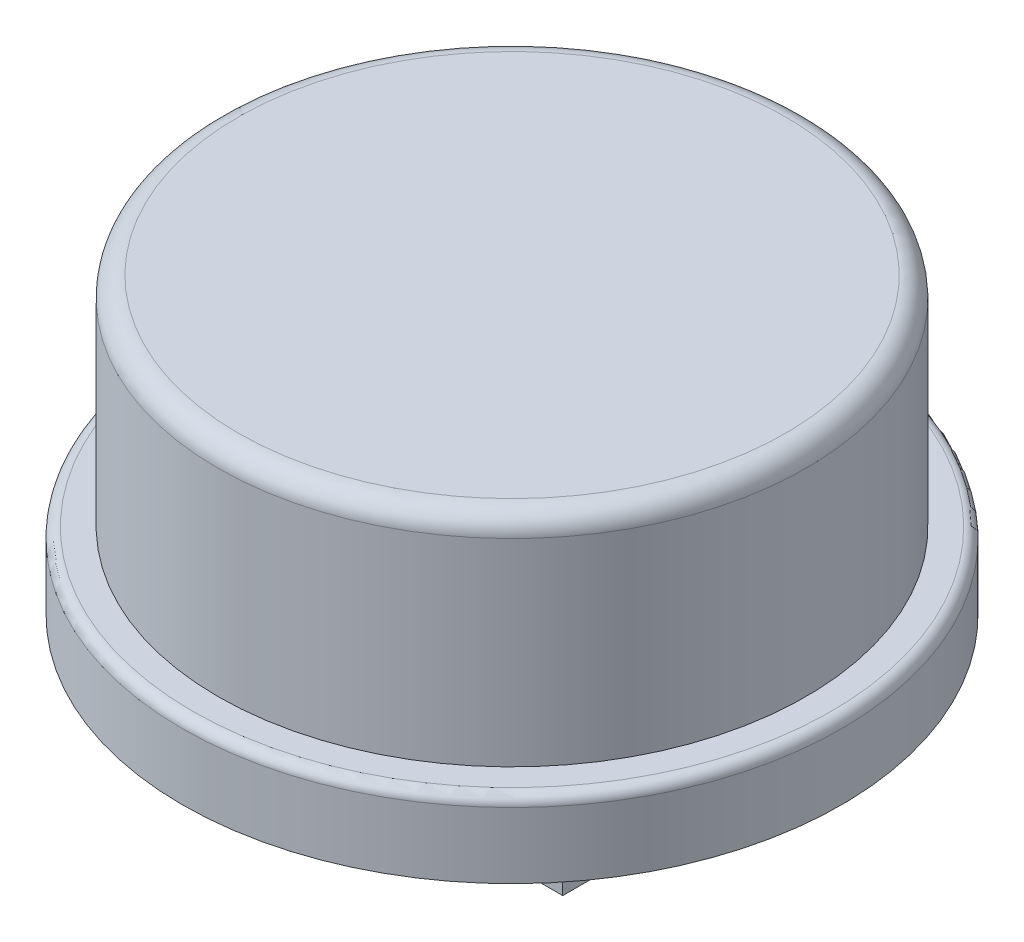
from build123d import *

# Parameters (mm, degrees)
SKETCH1_R           = 6.5
BOSS_EXTRUDE1_DEPTH = 1.5
SKETCH2_R           = 5.8
BOSS_EXTRUDE2_DEPTH = 4.3
FILLET1_R           = 0.4
SKETCH3_R           = 5
CUT_EXTRUDE1_DEPTH  = 4.8
BOSS_EXTRUDE3_START = 4.8
BOSS_EXTRUDE3_DEPTH = 4.8
SKETCH5_W           = 2
SKETCH5_H           = 0.8
SKETCH5_W_2         = 1
SKETCH5_H_2         = 3.8
BOSS_EXTRUDE4_DEPTH = 7.2
CUT_EXTRUDE2_REACH  = 14.102
BOSS_EXTRUDE5_DEPTH = 3.8
FILLET2_R           = 0.1
FILLET3_R           = 0.2


with BuildPart() as part:
    # Sketch1 → Boss-Extrude1 (new body)
    with BuildSketch(Plane(origin=(0, 0, 0), x_dir=(1, 0, 0), z_dir=(0, 1, 0))):
        with Locations(Location((0, 0, 0), (0, 0, 270))):
            Circle(SKETCH1_R)
    extrude(amount=BOSS_EXTRUDE1_DEPTH)

    # Sketch2 → Boss-Extrude2 (add)
    with BuildSketch(Plane(origin=(0, 1.5, 0), x_dir=(1, 0, 0), z_dir=(0, 1, 0))):
        with Locations(Location((0, 0, 0), (0, 0, 90))):
            Circle(SKETCH2_R)
    extrude(amount=BOSS_EXTRUDE2_DEPTH)

    # Fillet1
    fillet1_edges = [part.edges().sort_by_distance(p)[0] for p in [
        (0, 5.8, 5.8),
    ]]
    fillet(fillet1_edges, radius=FILLET1_R)

    # Sketch3 → Cut-Extrude1 (cut)
    with BuildSketch(Plane.XZ):
        with Locations(Location((0, 0, 0), (0, 0, 270))):
            Circle(SKETCH3_R)
    extrude(amount=-CUT_EXTRUDE1_DEPTH, mode=Mode.SUBTRACT)

    # Sketch4 → Boss-Extrude3 (add)
    with BuildSketch(Plane.XZ.offset(-4.8).offset(BOSS_EXTRUDE3_START)):
        with BuildLine():
            Line((-4.990991885, 0.3), (-2.9, 0.3))
            Line((-2.9, 0.3), (-2.9, -0.3))
            Line((-2.9, -0.3), (-4.990991885, -0.3))
            ThreePointArc((-4.990991885, -0.3), (-5, 0), (-4.990991885, 0.3))
        make_face()
        with BuildLine():
            Line((2.9, 0.3), (2.9, -0.3))
            Line((2.9, -0.3), (4.990991885, -0.3))
            ThreePointArc((4.990991885, -0.3), (5, 0), (4.990991885, 0.3))
            Line((4.990991885, 0.3), (2.9, 0.3))
        make_face()
        with BuildLine():
            Line((-0.3, 4.990991885), (-0.3, 2.7))
            Line((-0.3, 2.7), (0.3, 2.7))
            Line((0.3, 2.7), (0.3, 4.990991885))
            ThreePointArc((0.3, 4.990991885), (0, 5), (-0.3, 4.990991885))
        make_face()
        with BuildLine():
            Line((0.3, -2.7), (-0.3, -2.7))
            Line((-0.3, -2.7), (-0.3, -4.990991885))
            ThreePointArc((-0.3, -4.990991885), (0, -5), (0.3, -4.990991885))
            Line((0.3, -4.990991885), (0.3, -2.7))
        make_face()
    extrude(amount=-BOSS_EXTRUDE3_DEPTH)

    # Sketch5 → Boss-Extrude4 (add)
    with BuildSketch(Plane.XZ.offset(-4.8)):
        with Locations((0, 2.3)):
            Rectangle(SKETCH5_W, SKETCH5_H)
        with Locations((-2.4, 0)):
            Rectangle(SKETCH5_W_2, SKETCH5_H_2)
        with Locations((2.4, 0)):
            Rectangle(SKETCH5_W_2, SKETCH5_H_2)
        with Locations((0, -2.3)):
            Rectangle(SKETCH5_W, SKETCH5_H)
    extrude(amount=BOSS_EXTRUDE4_DEPTH)

    # Sketch6 → Cut-Extrude2 (cut, up to next)
    with BuildSketch(Plane.XY.offset(1.9), mode=Mode.PRIVATE) as cut_extrude2_sk1:
        Polygon((-1.9, -2.4), (-1.9, -1.9625), (-2.4, -2.4), align=None)
    cut_extrude2_tool1 = extrude(cut_extrude2_sk1.sketch, amount=-CUT_EXTRUDE2_REACH, mode=Mode.PRIVATE) & part.part
    # Sketch6 → Cut-Extrude2 (cut, up to next)
    with BuildSketch(Plane.XY.offset(1.9), mode=Mode.PRIVATE) as cut_extrude2_sk2:
        Polygon((1.9, -1.9625), (1.9, -2.4), (2.4, -2.4), align=None)
    cut_extrude2_tool2 = extrude(cut_extrude2_sk2.sketch, amount=-CUT_EXTRUDE2_REACH, mode=Mode.PRIVATE) & part.part
    add(cut_extrude2_tool1.solids().sort_by_distance((-2.066667, -2.254167, 1.9))[0], mode=Mode.SUBTRACT)
    add(cut_extrude2_tool2.solids().sort_by_distance((2.066667, -2.254167, 1.9))[0], mode=Mode.SUBTRACT)

    # Sketch6<3> → Boss-Extrude5 (add)
    with BuildSketch(Plane.XY.offset(1.9)):
        Polygon((-1.6, -1.7), (-1.9, -1.4), (-1.9, -1.9625), align=None)
        Polygon((1.6, -1.7), (1.9, -1.9625), (1.9, -1.4), align=None)
    extrude(amount=-BOSS_EXTRUDE5_DEPTH)

    # Fillet2
    fillet2_edges = [part.edges().sort_by_distance(p)[0] for p in [
        (-1.6, -1.7, 0),
        (1.6, -1.7, 0),
    ]]
    fillet(fillet2_edges, radius=FILLET2_R)

    # Fillet3
    fillet3_edges = [part.edges().sort_by_distance(p)[0] for p in [
        (0, 1.5, -6.5),
    ]]
    fillet(fillet3_edges, radius=FILLET3_R)


solid = part.part
